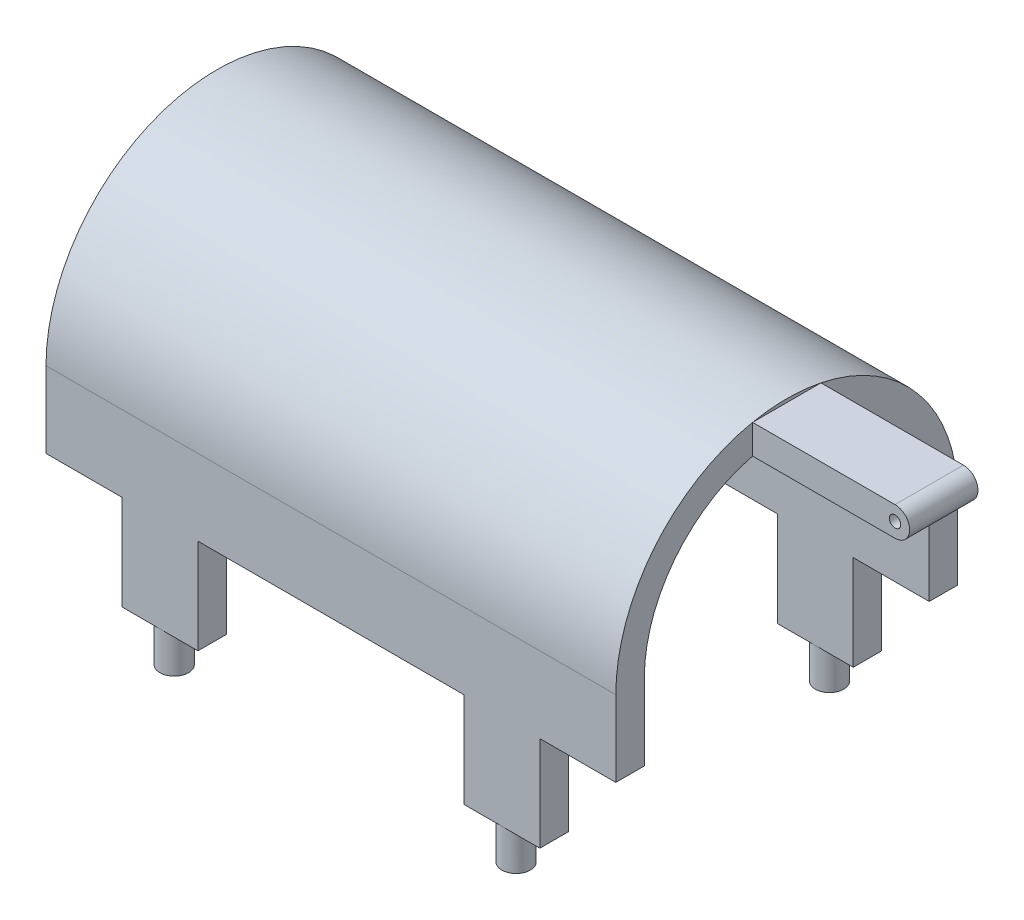
from build123d import *

# Parameters (mm, degrees)
BOSS_EXTRUDE1_DEPTH = 19.05
SKETCH2_W           = 4.572
SKETCH2_H           = 1.952455346
BOSS_EXTRUDE2_DEPTH = 9.525
SKETCH3_R           = 0.976227673
BOSS_EXTRUDE3_DEPTH = 4.572
SKETCH4_R           = 0.381
CUT_EXTRUDE1_DEPTH  = 35.526057015
SKETCH5_W           = 5.08
SKETCH5_H           = 6.35
SKETCH5_W_2         = 17.78
CUT_EXTRUDE2_DEPTH  = 40.070443522
SKETCH6_R           = 0.9525
BOSS_EXTRUDE4_DEPTH = 2.54


with BuildPart() as part:
    # Sketch1 → Boss-Extrude1 (new, symmetric)
    with BuildSketch(Plane(origin=(0, 0, 0), x_dir=(0, 0, -1), z_dir=(1, 0, 0))):
        with BuildLine():
            Line((-9.525, 0), (-9.525, -11.43))
            Line((-9.525, -11.43), (-11.43, -11.43))
            Line((-11.43, -11.43), (-11.43, 0))
            ThreePointArc((-11.43, 0), (0, 11.43), (11.43, 0))
            Line((11.43, 0), (11.43, -11.43))
            Line((11.43, -11.43), (9.525, -11.43))
            Line((9.525, -11.43), (9.525, 0))
            ThreePointArc((9.525, 0), (0, 9.525), (-9.525, 0))
        make_face()
    extrude(amount=BOSS_EXTRUDE1_DEPTH, both=True)

    # Sketch2 → Boss-Extrude2 (add, symmetric)
    with BuildSketch(Plane(origin=(19.05, 0, 0), x_dir=(0, 0, -1), z_dir=(1, 0, 0))):
        with Locations((0, 10.222839431)):
            Rectangle(SKETCH2_W, SKETCH2_H)
    extrude(amount=BOSS_EXTRUDE2_DEPTH, both=True)

    # Sketch3 → Boss-Extrude3 (add)
    with BuildSketch(Plane(origin=(0, 0, -2.286), x_dir=(-1, 0, 0), z_dir=(0, 0, -1))):
        with Locations((-28.575, 10.222839431)):
            Circle(SKETCH3_R)
    extrude(amount=-BOSS_EXTRUDE3_DEPTH)

    # Sketch4 → Cut-Extrude1 (cut, through all)
    with BuildSketch(Plane(origin=(0, 0, -2.286), x_dir=(-1, 0, 0), z_dir=(0, 0, -1))):
        with Locations((-28.575, 10.222839431)):
            Circle(SKETCH4_R)
    extrude(amount=-CUT_EXTRUDE1_DEPTH, mode=Mode.SUBTRACT)

    # Sketch5 → Cut-Extrude2 (cut, through all)
    with BuildSketch(Plane(origin=(0, 0, -11.43), x_dir=(-1, 0, 0), z_dir=(0, 0, -1))):
        with Locations((-16.51, -8.255)):
            Rectangle(SKETCH5_W, SKETCH5_H)
        with Locations((0, -8.255)):
            Rectangle(SKETCH5_W_2, SKETCH5_H)
        with Locations((16.51, -8.255)):
            Rectangle(SKETCH5_W, SKETCH5_H)
    extrude(amount=-CUT_EXTRUDE2_DEPTH, mode=Mode.SUBTRACT)

    # Sketch6 → Boss-Extrude4 (add)
    with BuildSketch(Plane.XZ.offset(11.43)):
        with Locations(Location((11.43, -10.4775, 0), (0, 0, 270))):
            Circle(SKETCH6_R)
        with Locations(Location((11.43, 10.4775, 0), (0, 0, 90))):
            Circle(SKETCH6_R)
        with Locations(Location((-11.43, 10.4775, 0), (0, 0, 270))):
            Circle(SKETCH6_R)
        with Locations(Location((-11.43, -10.4775, 0), (0, 0, 90))):
            Circle(SKETCH6_R)
    extrude(amount=BOSS_EXTRUDE4_DEPTH)


solid = part.part
